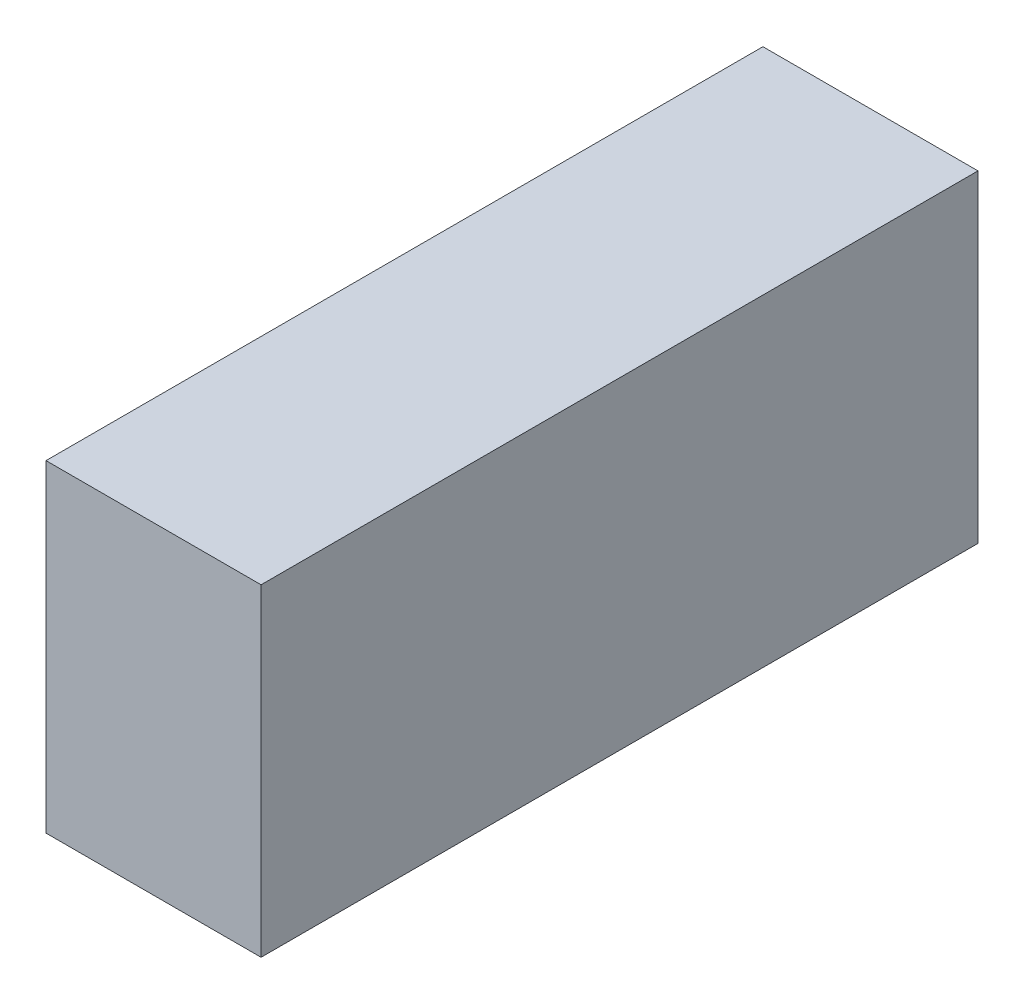
from build123d import *

# Parameters (mm, degrees)
ESQUISSE1_W             = 60
ESQUISSE1_H             = 90
BOSS_EXTRU_1_DEPTH      = 200
ESQUISSE2_R             = 2.5
ENL_V_MAT_EXTRU_1_DEPTH = 10


with BuildPart() as part:
    # Esquisse1 → Boss.-Extru.1 (new body)
    with BuildSketch(Plane.XY):
        with Locations((33.928030549, 135.537456897)):
            Rectangle(ESQUISSE1_W, ESQUISSE1_H)
    extrude(amount=BOSS_EXTRU_1_DEPTH)

    # Esquisse2 → Enlèv. mat.-Extru.1 (cut)
    with BuildSketch(Plane(origin=(0, 0, 0), x_dir=(-1, 0, 0), z_dir=(0, 0, -1))):
        with Locations((-57.928030549, 105.537456897)):
            Circle(ESQUISSE2_R)
        with Locations((-9.928030549, 105.537456897)):
            Circle(ESQUISSE2_R)
        with Locations((-9.928030549, 165.537456897)):
            Circle(ESQUISSE2_R)
        with Locations((-57.928030549, 165.537456897)):
            Circle(ESQUISSE2_R)
    extrude(amount=-ENL_V_MAT_EXTRU_1_DEPTH, mode=Mode.SUBTRACT)


solid = part.part
